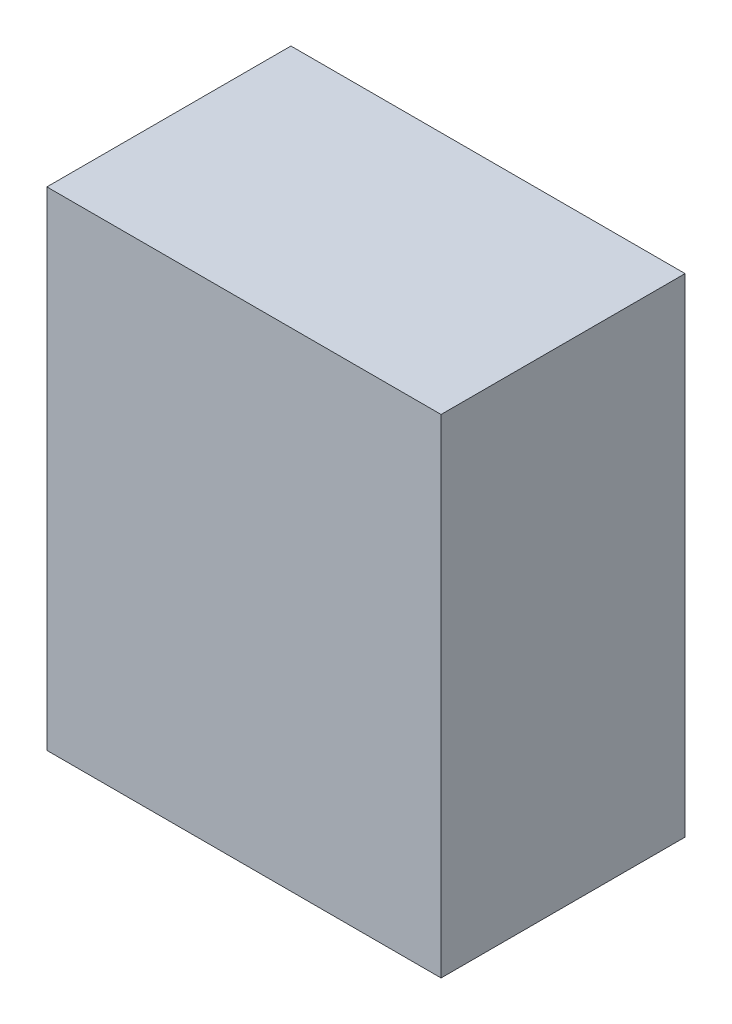
from build123d import *

# Parameters (mm, degrees)
SKETCH1_W           = 42
SKETCH1_H           = 52
BOSS_EXTRUDE1_DEPTH = 26


with BuildPart() as part:
    # Sketch1 → Boss-Extrude1 (new body)
    with BuildSketch(Plane(origin=(0, 0, 0), x_dir=(-1, 0, 0), z_dir=(0, 0, -1))):
        with Locations((-21, -26)):
            Rectangle(SKETCH1_W, SKETCH1_H)
    extrude(amount=-BOSS_EXTRUDE1_DEPTH)


solid = part.part
